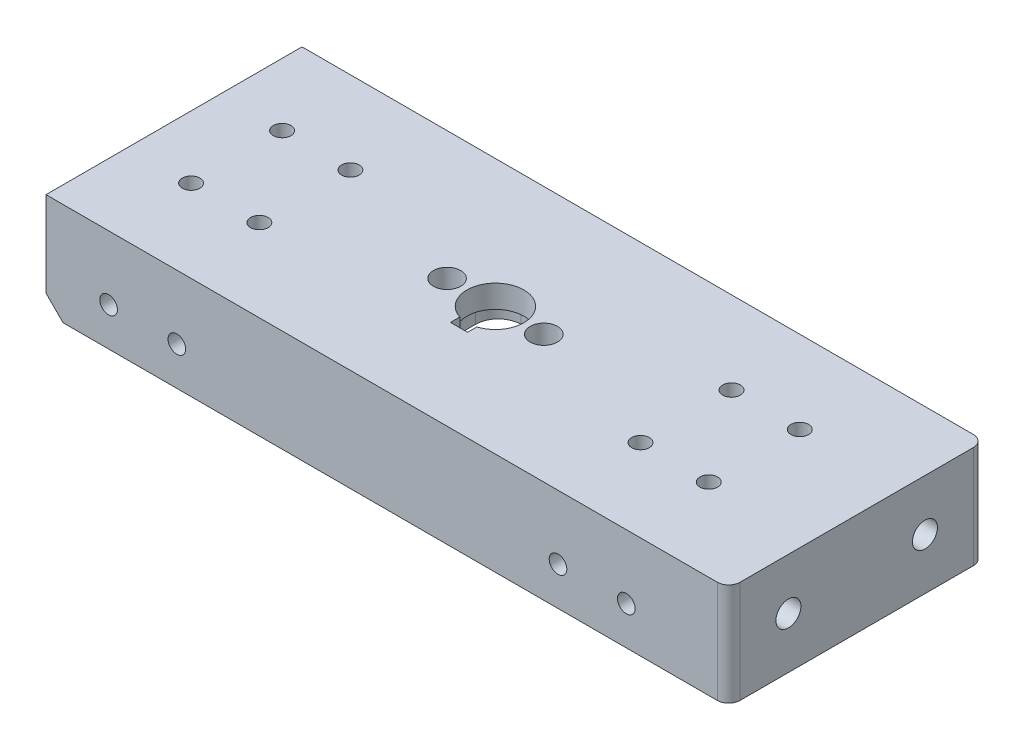
from build123d import *

# Parameters (mm, degrees)
SKETCH1_W                      = 113
SKETCH1_H                      = 45
BOSS_EXTRUDE1_DEPTH            = 4
M2_5_CLEARANCE_HOLE2_D         = 3.1
SKETCH5_W                      = 113
SKETCH5_H                      = 8.175
BOSS_EXTRUDE2_DEPTH            = 14
BOSS_EXTRUDE3_REACH            = 124.955
SKETCH7_W                      = 44
SKETCH7_H                      = 28.65
M2_5_CLEARANCE_HOLE1_D         = 3.1
SKETCH11_W                     = 34
SKETCH11_H                     = 35
CUT_EXTRUDE1_DEPTH             = 14
F_10_0MM_DOWEL_HOLE1_D         = 10
FILLET1_R                      = 4
CUT_EXTRUDE2_DEPTH             = 123.955276422
CUT_EXTRUDE2_DEPTH_BACK        = 14
SKETCH15_R                     = 1.6
FILLET2_R                      = 3.2
CHAMFER1_SIZE                  = 3
SKETCH20_W                     = 3
SKETCH20_H                     = 1.630303993
CUT_EXTRUDE4_DEPTH             = 123.433655504
M4_CLEARANCE_HOLE2_D           = 4.8
BOSS_EXTRUDE5_DEPTH            = 2
BOSS_EXTRUDE5_DEPTH_BACK       = 3
SKETCH29_W                     = 45
SKETCH29_H                     = 18
BOSS_EXTRUDE6_DEPTH            = 5
CHAMFER2_SIZE                  = 1.75
F_4_4_4_4_DIAMETER_HOLE1_D     = 4.4
F_4_4_4_4_DIAMETER_HOLE1_DEPTH = 5
FILLET3_R                      = 2


with BuildPart() as part:
    # Sketch1 → Boss-Extrude1 (new body)
    with BuildSketch(Plane(origin=(0, 0, 0), x_dir=(1, 0, 0), z_dir=(0, 1, 0))):
        with Locations((56.5, 22.5)):
            Rectangle(SKETCH1_W, SKETCH1_H)
    extrude(amount=BOSS_EXTRUDE1_DEPTH)

    # M2.5 Clearance Hole2 (through all)
    with Locations(Plane(origin=(0, 4, 0), x_dir=(1, 0, 0), z_dir=(0, 1, 0))):
        with Locations((11, 30.5), (23, 30.5), (23, 14.5), (11, 14.5), (102, 14.5), (90, 14.5), (90, 30.5), (102, 30.5)):
            Hole(M2_5_CLEARANCE_HOLE2_D / 2)

    # Sketch5 → Boss-Extrude2 (add)
    with BuildSketch(Plane.XZ):
        with Locations((56.5, -4.0875)):
            Rectangle(SKETCH5_W, SKETCH5_H)
        with Locations((56.5, -40.9125)):
            Rectangle(SKETCH5_W, SKETCH5_H)
    extrude(amount=BOSS_EXTRUDE2_DEPTH)

    # Sketch7 → Boss-Extrude3 (add, up to next)
    with BuildSketch(Plane.XZ.offset(14), mode=Mode.PRIVATE) as boss_extrude3_sk1:
        with Locations((56.5, -22.5)):
            Rectangle(SKETCH7_W, SKETCH7_H)
    boss_extrude3_tool1 = extrude(boss_extrude3_sk1.sketch, amount=-BOSS_EXTRUDE3_REACH, mode=Mode.PRIVATE) - part.part
    add(boss_extrude3_tool1.solids().sort_by_distance((56.5, -14, -22.5))[0])

    # M2.5 Clearance Hole1 (through all)
    with Locations(Plane(origin=(0, 0, -45), x_dir=(-1, 0, 0), z_dir=(0, 0, -1))):
        with Locations((-11, -7.25), (-23, -7.25), (-102, -7.25), (-90, -7.25)):
            Hole(M2_5_CLEARANCE_HOLE1_D / 2)

    # Sketch11 → Cut-Extrude1 (cut)
    with BuildSketch(Plane.XZ.offset(14)):
        with Locations((56.5, -22.5)):
            Rectangle(SKETCH11_W, SKETCH11_H)
    extrude(amount=-CUT_EXTRUDE1_DEPTH, mode=Mode.SUBTRACT)

    # Ø10.0mm Dowel Hole1 (through all)
    with Locations(Plane(origin=(0, 4, 0), x_dir=(1, 0, 0), z_dir=(0, 1, 0))):
        with Locations((56.5, 22.5)):
            Hole(F_10_0MM_DOWEL_HOLE1_D / 2)

    # Fillet1
    fillet1_edges = [part.edges().sort_by_distance(p)[0] for p in [
        (73.5, -7, -40),
        (39.5, -7, -40),
        (39.5, -7, -5),
        (73.5, -7, -5),
    ]]
    fillet(fillet1_edges, radius=FILLET1_R)

    # Sketch15 → Cut-Extrude2 (cut, two sides: drawn at the far end of the back side and taken through both)
    with BuildSketch(Plane.XZ.offset(14).offset(-CUT_EXTRUDE2_DEPTH_BACK)):
        with Locations((34.5, -9.775)):
            Circle(SKETCH15_R)
        with Locations((34.5, -35.225)):
            Circle(SKETCH15_R)
        with Locations((78.5, -9.775)):
            Circle(SKETCH15_R)
        with Locations((78.5, -35.225)):
            Circle(SKETCH15_R)
    extrude(amount=CUT_EXTRUDE2_DEPTH + CUT_EXTRUDE2_DEPTH_BACK, mode=Mode.SUBTRACT)

    # Fillet2
    fillet2_edges = [part.edges().sort_by_distance(p)[0] for p in [
        (78.5, -7, -33.625),
        (78.5, -7, -11.375),
        (34.5, -7, -33.625),
        (34.5, -7, -11.375),
    ]]
    fillet(fillet2_edges, radius=FILLET2_R)

    # Chamfer1
    chamfer1_edges = [part.edges().sort_by_distance(p)[0] for p in [
        (113, -14, -40.9125),
        (113, -14, -4.0875),
        (0, -14, -40.9125),
        (0, -14, -4.0875),
    ]]
    chamfer(chamfer1_edges, length=CHAMFER1_SIZE)

    # Sketch20 → Cut-Extrude4 (cut, through all)
    with BuildSketch(Plane.XZ):
        with Locations((56.5, -16.915151997)):
            Rectangle(SKETCH20_W, SKETCH20_H)
    extrude(amount=-CUT_EXTRUDE4_DEPTH, mode=Mode.SUBTRACT)

    # M4 Clearance Hole2 (through all)
    with Locations(Plane(origin=(0, 0, 0), x_dir=(-1, 0, 0), z_dir=(0, -1, 0))):
        with Locations((-48, 22.5), (-65, 22.5)):
            Hole(M4_CLEARANCE_HOLE2_D / 2)

    # Sketch28 → Boss-Extrude5 (add, two sides: drawn at the far end of the back side and taken through both)
    with BuildSketch(Plane(origin=(113, 0, 0), x_dir=(0, 0, -1), z_dir=(1, 0, 0)).offset(-BOSS_EXTRUDE5_DEPTH_BACK)):
        Polygon((45, -14), (45, -11), (45, 4), (0, 4), (0, -11), (0, -14), (8.175, -14), (8.175, -11), (8.175, 0), (36.825, 0), (36.825, -11), (36.825, -14), align=None)
    extrude(amount=BOSS_EXTRUDE5_DEPTH + BOSS_EXTRUDE5_DEPTH_BACK)

    # Sketch29 → Boss-Extrude6 (add)
    with BuildSketch(Plane(origin=(115, 0, 0), x_dir=(0, 0, -1), z_dir=(1, 0, 0))):
        with Locations((22.5, -5)):
            Rectangle(SKETCH29_W, SKETCH29_H)
    extrude(amount=BOSS_EXTRUDE6_DEPTH)

    # Chamfer2
    chamfer2_edges = [part.edges().sort_by_distance(p)[0] for p in [
        (115, -7, -8.175),
        (115, -7, -36.825),
    ]]
    chamfer(chamfer2_edges, length=CHAMFER2_SIZE)

    # Ø4.4 (4.4) Diameter Hole1
    with Locations(Plane(origin=(120, 0, 0), x_dir=(0, 0, -1), z_dir=(1, 0, 0))):
        with Locations((34.5, -5), (10.5, -5)):
            Hole(F_4_4_4_4_DIAMETER_HOLE1_D / 2, depth=F_4_4_4_4_DIAMETER_HOLE1_DEPTH)

    # Fillet3
    fillet3_edges = [part.edges().sort_by_distance(p)[0] for p in [
        (120, -5, 0),
        (120, -5, -45),
    ]]
    fillet(fillet3_edges, radius=FILLET3_R)


solid = part.part
